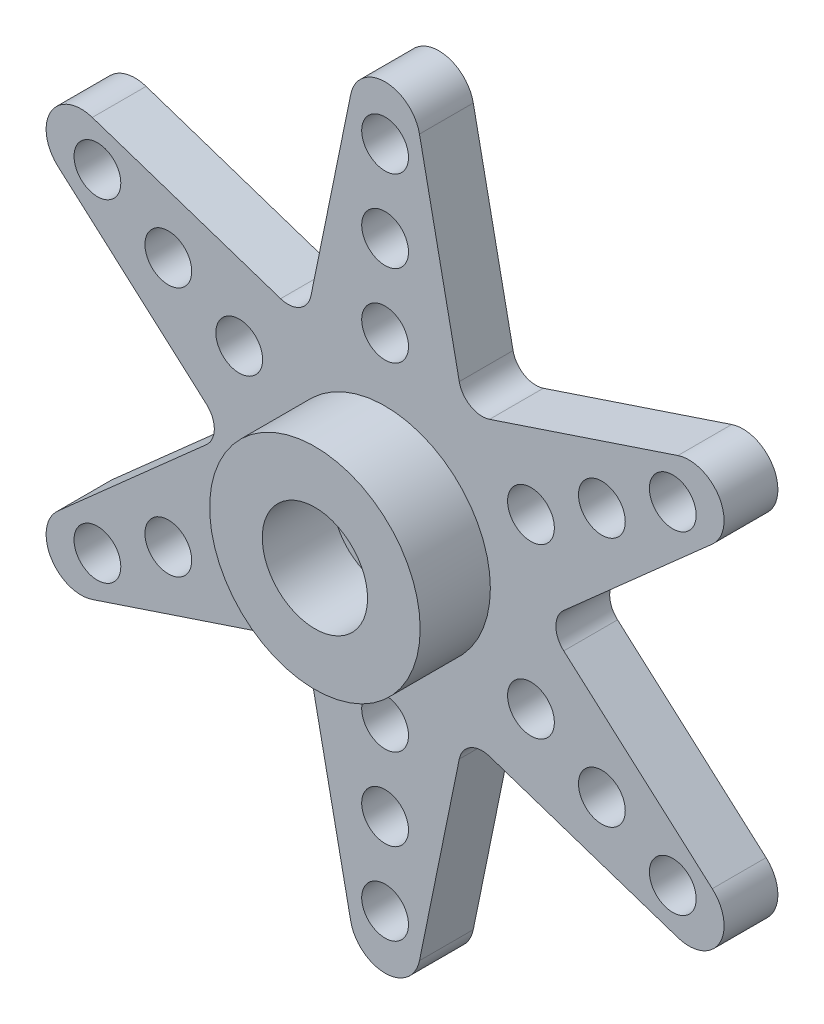
from build123d import *

# Parameters (mm, degrees)
SKETCH1_R           = 1
BOSS_EXTRUDE1_DEPTH = 2.3
CUT_EXTRUDE1_REACH  = 24.08
SKETCH2_R           = 1.5
SKETCH3_R           = 4.5
SKETCH3_R_2         = 2.25
BOSS_EXTRUDE2_DEPTH = 3


with BuildPart() as part:
    # Sketch1 → Boss-Extrude1 (new body)
    with BuildSketch(Plane.XY):
        with BuildLine():
            Line((-3.170292714, 6.987577235), (-1.469560928, 15.300650424))
            ThreePointArc((-1.469560928, 15.300650424), (0, 16.5), (1.469560928, 15.300650424))
            Line((1.469560928, 15.300650424), (3.170292714, 6.987577235))
            ThreePointArc((3.170292714, 6.987577235), (3.65, 6.321985448), (4.466273039, 6.239342646))
            Line((4.466273039, 6.239342646), (12.515971498, 8.923002309))
            ThreePointArc((12.515971498, 8.923002309), (14.289419162, 8.25), (13.985532426, 6.377648116))
            Line((13.985532426, 6.377648116), (7.636565754, 0.748234589))
            ThreePointArc((7.636565754, 0.748234589), (7.3, 0), (7.636565754, -0.748234589))
            Line((7.636565754, -0.748234589), (13.985532426, -6.377648116))
            ThreePointArc((13.985532426, -6.377648116), (14.289419162, -8.25), (12.515971498, -8.923002309))
            Line((12.515971498, -8.923002309), (4.466273039, -6.239342646))
            ThreePointArc((4.466273039, -6.239342646), (3.65, -6.321985448), (3.170292714, -6.987577235))
            Line((3.170292714, -6.987577235), (1.469560928, -15.300650424))
            ThreePointArc((1.469560928, -15.300650424), (0, -16.5), (-1.469560928, -15.300650424))
            Line((-1.469560928, -15.300650424), (-3.170292714, -6.987577235))
            ThreePointArc((-3.170292714, -6.987577235), (-3.65, -6.321985448), (-4.466273039, -6.239342646))
            Line((-4.466273039, -6.239342646), (-12.515971498, -8.923002309))
            ThreePointArc((-12.515971498, -8.923002309), (-14.289419162, -8.25), (-13.985532426, -6.377648116))
            Line((-13.985532426, -6.377648116), (-7.636565754, -0.748234589))
            ThreePointArc((-7.636565754, -0.748234589), (-7.3, 0), (-7.636565754, 0.748234589))
            Line((-7.636565754, 0.748234589), (-13.985532426, 6.377648116))
            ThreePointArc((-13.985532426, 6.377648116), (-14.289419162, 8.25), (-12.515971498, 8.923002309))
            Line((-12.515971498, 8.923002309), (-4.466273039, 6.239342646))
            ThreePointArc((-4.466273039, 6.239342646), (-3.65, 6.321985448), (-3.170292714, 6.987577235))
        make_face()
        with Locations((0, 14.2)):
            Circle(SKETCH1_R, mode=Mode.SUBTRACT)
        with Locations((0, 10.7)):
            Circle(SKETCH1_R, mode=Mode.SUBTRACT)
        with Locations((0, 7.2)):
            Circle(SKETCH1_R, mode=Mode.SUBTRACT)
        with Locations((6.235382907, 3.6)):
            Circle(SKETCH1_R, mode=Mode.SUBTRACT)
        with Locations((9.26647182, 5.35)):
            Circle(SKETCH1_R, mode=Mode.SUBTRACT)
        with Locations((12.297560734, 7.1)):
            Circle(SKETCH1_R, mode=Mode.SUBTRACT)
        with Locations((6.235382907, -3.6)):
            Circle(SKETCH1_R, mode=Mode.SUBTRACT)
        with Locations((9.26647182, -5.35)):
            Circle(SKETCH1_R, mode=Mode.SUBTRACT)
        with Locations((12.297560734, -7.1)):
            Circle(SKETCH1_R, mode=Mode.SUBTRACT)
        with Locations((0, -7.2)):
            Circle(SKETCH1_R, mode=Mode.SUBTRACT)
        with Locations((0, -10.7)):
            Circle(SKETCH1_R, mode=Mode.SUBTRACT)
        with Locations((0, -14.2)):
            Circle(SKETCH1_R, mode=Mode.SUBTRACT)
        with Locations((-6.235382907, -3.6)):
            Circle(SKETCH1_R, mode=Mode.SUBTRACT)
        with Locations((-9.26647182, -5.35)):
            Circle(SKETCH1_R, mode=Mode.SUBTRACT)
        with Locations((-12.297560734, -7.1)):
            Circle(SKETCH1_R, mode=Mode.SUBTRACT)
        with Locations((-6.235382907, 3.6)):
            Circle(SKETCH1_R, mode=Mode.SUBTRACT)
        with Locations((-9.26647182, 5.35)):
            Circle(SKETCH1_R, mode=Mode.SUBTRACT)
        with Locations((-12.297560734, 7.1)):
            Circle(SKETCH1_R, mode=Mode.SUBTRACT)
    extrude(amount=BOSS_EXTRUDE1_DEPTH)

    # Sketch2 → Cut-Extrude1 (cut, up to next)
    with BuildSketch(Plane.XY.offset(2.3), mode=Mode.PRIVATE) as cut_extrude1_sk1:
        Circle(SKETCH2_R)
    cut_extrude1_tool1 = extrude(cut_extrude1_sk1.sketch, amount=-CUT_EXTRUDE1_REACH, mode=Mode.PRIVATE) & part.part
    add(cut_extrude1_tool1.solids().sort_by_distance((0, 0, 2.3))[0], mode=Mode.SUBTRACT)

    # Sketch3 → Boss-Extrude2 (add)
    with BuildSketch(Plane.XY.offset(2.3)):
        Circle(SKETCH3_R)
        Circle(SKETCH3_R_2, mode=Mode.SUBTRACT)
    extrude(amount=BOSS_EXTRUDE2_DEPTH)


solid = part.part
